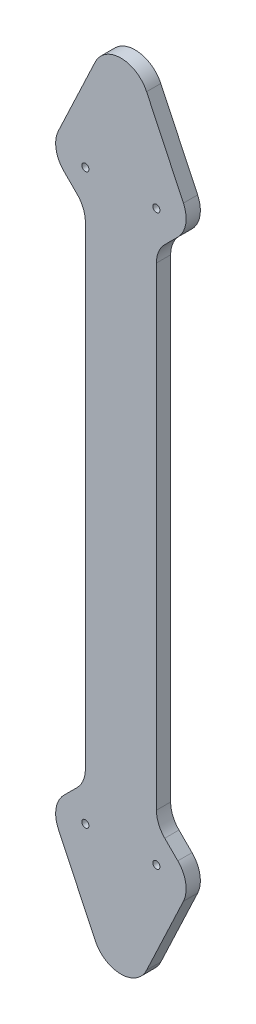
from build123d import *

# Parameters (mm, degrees)
SKETCH1_R           = 0.5
BOSS_EXTRUDE1_DEPTH = 2


with BuildPart() as part:
    # Sketch1 → Boss-Extrude1 (new body)
    with BuildSketch(Plane.XY):
        with BuildLine():
            Line((-3.617777686, 53.531365908), (-8.799601245, 42.545043716))
            ThreePointArc((-8.799601245, 42.545043716), (-9.122569183, 40.152730346), (-8.010250683, 38.010250683))
            Line((-8.010250683, 38.010250683), (-6.171572875, 36.171572875))
            ThreePointArc((-6.171572875, 36.171572875), (-5.30448187, 34.87387948), (-5, 33.343145751))
            Line((-5, 33.343145751), (-5, -33.343145751))
            ThreePointArc((-5, -33.343145751), (-5.30448187, -34.87387948), (-6.171572875, -36.171572875))
            Line((-6.171572875, -36.171572875), (-8.010250683, -38.010250683))
            ThreePointArc((-8.010250683, -38.010250683), (-9.122569183, -40.152730346), (-8.799601245, -42.545043716))
            Line((-8.799601245, -42.545043716), (-3.617777686, -53.531365908))
            ThreePointArc((-3.617777686, -53.531365908), (0, -55.825), (3.617777686, -53.531365908))
            Line((3.617777686, -53.531365908), (8.799601245, -42.545043716))
            ThreePointArc((8.799601245, -42.545043716), (9.122569183, -40.152730346), (8.010250683, -38.010250683))
            Line((8.010250683, -38.010250683), (6.171572875, -36.171572875))
            ThreePointArc((6.171572875, -36.171572875), (5.30448187, -34.87387948), (5, -33.343145751))
            Line((5, -33.343145751), (5, 33.343145751))
            ThreePointArc((5, 33.343145751), (5.30448187, 34.87387948), (6.171572875, 36.171572875))
            Line((6.171572875, 36.171572875), (8.010250683, 38.010250683))
            ThreePointArc((8.010250683, 38.010250683), (9.122569183, 40.152730346), (8.799601245, 42.545043716))
            Line((8.799601245, 42.545043716), (3.617777686, 53.531365908))
            ThreePointArc((3.617777686, 53.531365908), (0, 55.825), (-3.617777686, 53.531365908))
        make_face()
        with Locations((-5, 40)):
            Circle(SKETCH1_R, mode=Mode.SUBTRACT)
        with Locations(Location((5, 40, 0), (0, 0, 180))):
            Circle(SKETCH1_R, mode=Mode.SUBTRACT)
        with Locations((5, -40)):
            Circle(SKETCH1_R, mode=Mode.SUBTRACT)
        with Locations(Location((-5, -40, 0), (0, 0, 180))):
            Circle(SKETCH1_R, mode=Mode.SUBTRACT)
    extrude(amount=BOSS_EXTRUDE1_DEPTH)


solid = part.part
